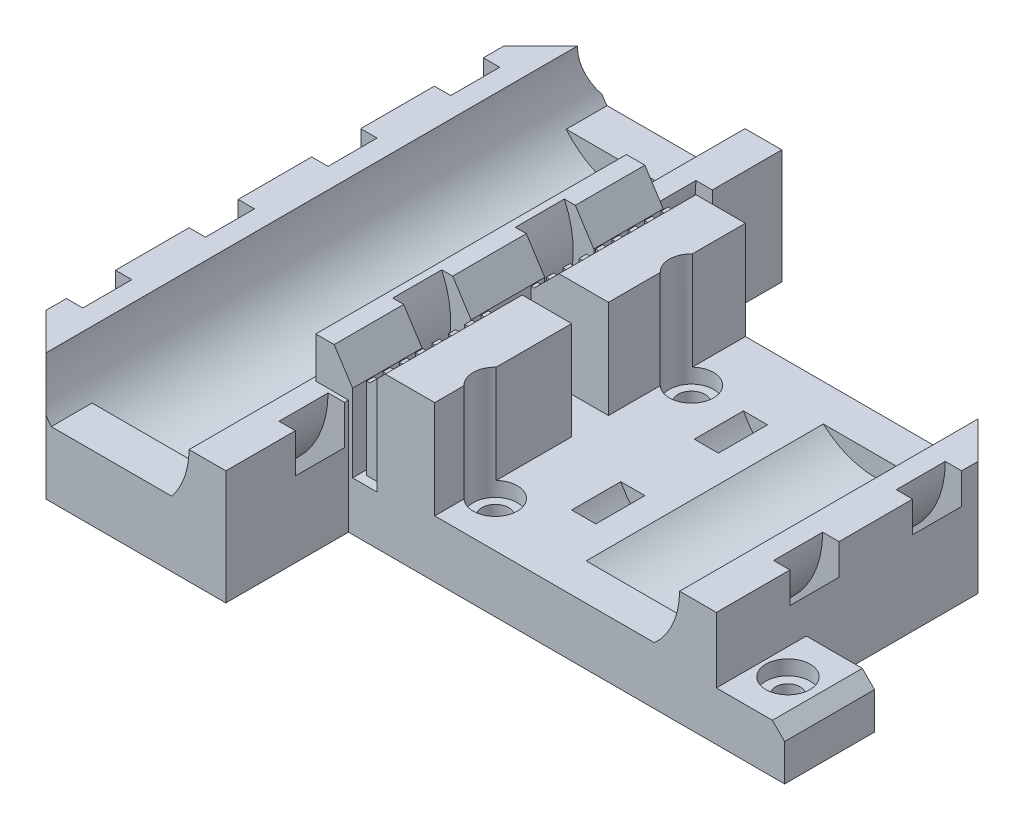
from build123d import *

# Parameters (mm, degrees)
SKETCH1_R           = 1.65
SKETCH1_R_2         = 1.5
BOSS_EXTRUDE1_DEPTH = 19
SKETCH2_W           = 28
SKETCH2_H           = 68
CUT_EXTRUDE1_DEPTH  = 5
SKETCH3_R           = 9.5
CUT_EXTRUDE2_DEPTH  = 79.787630581
SKETCH4_W           = 28
SKETCH4_H           = 5
BOSS_EXTRUDE3_DEPTH = 8
SKETCH5_W           = 2.8
SKETCH5_H           = 6
SKETCH7_W           = 4
SKETCH7_H           = 38
BOSS_EXTRUDE4_DEPTH = 5
SKETCH8_W           = 0.6
SKETCH8_H           = 38
CUT_EXTRUDE3_DEPTH  = 13
LPATTERN1_COUNT     = 4
LPATTERN1_PITCH     = 15
CUT_EXTRUDE4_DEPTH  = 54
SKETCH11_R          = 9.5
CUT_EXTRUDE6_DEPTH  = 75
SKETCH12_W          = 20.45
SKETCH12_H          = 38
CUT_EXTRUDE7_DEPTH  = 12
SKETCH14_W          = 14.272252789
SKETCH14_H          = 38
CUT_EXTRUDE9_DEPTH  = 5
SKETCH15_W          = 8.35
SKETCH15_H          = 11
CUT_EXTRUDE10_DEPTH = 8
SKETCH16_W          = 28.394140708
SKETCH16_H          = 4.5
SKETCH16_W_2        = 23.667282337
BOSS_EXTRUDE5_DEPTH = 7
SKETCH17_W          = 2.5
SKETCH17_H          = 6
LPATTERN2_COUNT     = 2
LPATTERN2_PITCH     = 15
SKETCH18_R          = 2.7
CUT_EXTRUDE11_DEPTH = 1.8
CUT_EXTRUDE12_START = 12
SKETCH19_R          = 2.7
CUT_EXTRUDE12_DEPTH = 13.8
SKETCH20_W          = 2.4
SKETCH20_H          = 1.11
CUT_EXTRUDE13_DEPTH = 13
LPATTERN3_COUNT     = 20
LPATTERN3_PITCH     = 2
CUT_EXTRUDE15_START = -19
SKETCH23_W          = 9.640158514
SKETCH23_H          = 12
CUT_EXTRUDE15_DEPTH = 2.25
CHAMFER2_SIZE       = 1.5
CHAMFER3_SIZE       = 6
CUT_EXTRUDE16_DEPTH = 56


with BuildPart() as part:
    # Sketch1 → Boss-Extrude1 (new body)
    with BuildSketch(Plane(origin=(0, 0, 0), x_dir=(1, 0, 0), z_dir=(0, 1, 0))):
        Polygon((0.38789484, -8.215418094), (0.38789484, 6.784581906), (53.73789484, 6.784581906), (53.73789484, 17.784581906), (45.38789484, 17.784581906), (45.38789484, 44.784581906), (0.38789484, 44.784581906), (0.38789484, 59.784581906), (-27.61210516, 59.784581906), (-27.61210516, -8.215418094), align=None)
        with Locations(Location((12.78789484, 36.334581906, 0), (0, 0, 270))):
            Circle(SKETCH1_R, mode=Mode.SUBTRACT)
        with Locations(Location((12.78789484, 12.334581906, 0), (0, 0, 270))):
            Circle(SKETCH1_R, mode=Mode.SUBTRACT)
        with Locations(Location((48.58789484, 12.334581906, 0), (0, 0, 270))):
            Circle(SKETCH1_R_2, mode=Mode.SUBTRACT)
    extrude(amount=BOSS_EXTRUDE1_DEPTH)

    # Sketch2 → Cut-Extrude1 (cut)
    with BuildSketch(Plane(origin=(0, 19, 0), x_dir=(1, 0, 0), z_dir=(0, 1, 0))):
        with Locations((-13.61210516, 25.784581906)):
            Rectangle(SKETCH2_W, SKETCH2_H)
    extrude(amount=-CUT_EXTRUDE1_DEPTH, mode=Mode.SUBTRACT)

    # Sketch3 → Cut-Extrude2 (cut)
    with BuildSketch(Plane.XY.offset(8.215418094)):
        with Locations((-13.61210516, 14)):
            Circle(SKETCH3_R)
    extrude(amount=-CUT_EXTRUDE2_DEPTH, mode=Mode.SUBTRACT)

    # Sketch4 → Boss-Extrude3 (add)
    with BuildSketch(Plane.XZ):
        with Locations((-13.61210516, 5.715418094)):
            Rectangle(SKETCH4_W, SKETCH4_H)
        with Locations((-13.61210516, -57.284581906)):
            Rectangle(SKETCH4_W, SKETCH4_H)
    extrude(amount=-BOSS_EXTRUDE3_DEPTH)

    # Sketch5 → Cut-Revolve2 (revolve, cut)
    with BuildSketch(Plane(origin=(0, 14, 0), x_dir=(1, 0, 0), z_dir=(0, 1, 0))):
        with Locations((-27.01210516, 3.284581906)):
            Rectangle(SKETCH5_W, SKETCH5_H)
    cut_revolve2 = revolve(axis=Axis((-13.61210516, 14, -59.784581906), (0, 0, 1)), mode=Mode.SUBTRACT)

    # Sketch7 → Boss-Extrude4 (add)
    with BuildSketch(Plane(origin=(0, 14, 0), x_dir=(1, 0, 0), z_dir=(0, 1, 0))):
        with Locations((-1.61210516, 25.784581906)):
            Rectangle(SKETCH7_W, SKETCH7_H)
    extrude(amount=BOSS_EXTRUDE4_DEPTH)

    # Sketch8 → Cut-Extrude3 (cut)
    with BuildSketch(Plane(origin=(0, 19, 0), x_dir=(1, 0, 0), z_dir=(0, 1, 0))):
        with Locations((1.18789484, 25.784581906)):
            Rectangle(SKETCH8_W, SKETCH8_H)
    extrude(amount=-CUT_EXTRUDE3_DEPTH, mode=Mode.SUBTRACT)

    # LPattern1: Cut-Revolve2 ×4
    with Locations(*[(0, 0, -i * LPATTERN1_PITCH) for i in range(1, LPATTERN1_COUNT)]):
        add(cut_revolve2, mode=Mode.SUBTRACT)

    # Sketch9 → Cut-Extrude4 (cut)
    with BuildSketch(Plane.XY.offset(-6.784581906)):
        Polygon((0.88789484, 19), (-1.36210516, 19), (0.88789484, 15.5), align=None)
    extrude(amount=-CUT_EXTRUDE4_DEPTH, mode=Mode.SUBTRACT)

    # Sketch11 → Cut-Extrude6 (cut)
    with BuildSketch(Plane.XY.offset(-6.784581906)):
        with Locations((31.38789484, 14)):
            Circle(SKETCH11_R)
    extrude(amount=-CUT_EXTRUDE6_DEPTH, mode=Mode.SUBTRACT)

    # Sketch12 → Cut-Extrude7 (cut)
    with BuildSketch(Plane(origin=(0, 19, 0), x_dir=(1, 0, 0), z_dir=(0, 1, 0))):
        with Locations((21.16289484, 25.784581906)):
            Rectangle(SKETCH12_W, SKETCH12_H)
    extrude(amount=-CUT_EXTRUDE7_DEPTH, mode=Mode.SUBTRACT)

    # Sketch14 → Cut-Extrude9 (cut)
    with BuildSketch(Plane(origin=(0, 19, 0), x_dir=(1, 0, 0), z_dir=(0, 1, 0))):
        with Locations((46.601768445, 25.784581906)):
            Rectangle(SKETCH14_W, SKETCH14_H)
    extrude(amount=-CUT_EXTRUDE9_DEPTH, mode=Mode.SUBTRACT)

    # Sketch15 → Cut-Extrude10 (cut)
    with BuildSketch(Plane(origin=(0, 14, 0), x_dir=(1, 0, 0), z_dir=(0, 1, 0))):
        with Locations((49.56289484, 12.284581906)):
            Rectangle(SKETCH15_W, SKETCH15_H)
    extrude(amount=-CUT_EXTRUDE10_DEPTH, mode=Mode.SUBTRACT)

    # Sketch16 → Boss-Extrude5 (add)
    with BuildSketch(Plane(origin=(0, 0, 0), x_dir=(-1, 0, 0), z_dir=(0, -1, 0))):
        with Locations((-30.406511334, 9.034581906)):
            Rectangle(SKETCH16_W, SKETCH16_H)
        with Locations((-33.554253671, 42.534581906)):
            Rectangle(SKETCH16_W_2, SKETCH16_H)
    extrude(amount=-BOSS_EXTRUDE5_DEPTH)

    # Sketch17 → Cut-Revolve3 (revolve, cut)
    with BuildSketch(Plane(origin=(0, 14, 0), x_dir=(1, 0, 0), z_dir=(0, 1, 0))):
        with Locations((44.63789484, 18.784581906)):
            Rectangle(SKETCH17_W, SKETCH17_H)
    cut_revolve3 = revolve(axis=Axis((31.38789484, 14, -44.784581906), (0, 0, 1)), mode=Mode.SUBTRACT)

    # LPattern2: Cut-Revolve3 ×2
    with Locations(*[(0, 0, -i * LPATTERN2_PITCH) for i in range(1, LPATTERN2_COUNT)]):
        add(cut_revolve3, mode=Mode.SUBTRACT)

    # Sketch18 → Cut-Extrude11 (cut)
    with BuildSketch(Plane(origin=(0, 6, 0), x_dir=(1, 0, 0), z_dir=(0, 1, 0))):
        with Locations(Location((48.58789484, 12.334581906, 0), (0, 0, 270))):
            Circle(SKETCH18_R)
    extrude(amount=-CUT_EXTRUDE11_DEPTH, mode=Mode.SUBTRACT)

    # Sketch19 → Cut-Extrude12 (cut)
    with BuildSketch(Plane(origin=(0, 7, 0), x_dir=(1, 0, 0), z_dir=(0, 1, 0)).offset(CUT_EXTRUDE12_START)):
        with Locations(Location((12.78789484, 36.334581906, 0), (0, 0, 270))):
            Circle(SKETCH19_R)
        with Locations(Location((12.78789484, 12.334581906, 0), (0, 0, 270))):
            Circle(SKETCH19_R)
    extrude(amount=-CUT_EXTRUDE12_DEPTH, mode=Mode.SUBTRACT)

    # Sketch20 → Cut-Extrude13 (cut)
    with BuildSketch(Plane(origin=(0, 19, 0), x_dir=(1, 0, 0), z_dir=(0, 1, 0))):
        with Locations((2.68789484, 43.339581906)):
            Rectangle(SKETCH20_W, SKETCH20_H)
    cut_extrude13 = extrude(amount=-CUT_EXTRUDE13_DEPTH, mode=Mode.SUBTRACT)

    # LPattern3: Cut-Extrude13 ×20
    with Locations(*[(0, 0, i * LPATTERN3_PITCH) for i in range(1, LPATTERN3_COUNT)]):
        add(cut_extrude13, mode=Mode.SUBTRACT)

    # Sketch23 → Cut-Extrude15 (cut, symmetric)
    with BuildSketch(Plane.XY.offset(-6.784581906).offset(CUT_EXTRUDE15_START)):
        with Locations((6.117815583, 13)):
            Rectangle(SKETCH23_W, SKETCH23_H)
    extrude(amount=CUT_EXTRUDE15_DEPTH, both=True, mode=Mode.SUBTRACT)

    # Chamfer2
    chamfer2_edges = [part.edges().sort_by_distance(p)[0] for p in [
        (53.73789484, 6, -12.284581906),
    ]]
    chamfer(chamfer2_edges, length=CHAMFER2_SIZE)

    # Chamfer3
    chamfer3_edges = [part.edges().sort_by_distance(p)[0] for p in [
        (45.38789484, 7, -44.784581906),
        (-27.61210516, 7, -59.784581906),
        (-27.61210516, 7, 8.215418094),
    ]]
    chamfer(chamfer3_edges, length=CHAMFER3_SIZE)

    # Sketch24 → Cut-Extrude16 (cut)
    with BuildSketch(Plane(origin=(0, 0, -44.784581906), x_dir=(-1, 0, 0), z_dir=(0, 0, -1))):
        Polygon((-1.48789484, 19), (-1.48789484, 16), (-1.88789484, 16), (-4.88789484, 19), align=None)
    extrude(amount=-CUT_EXTRUDE16_DEPTH, mode=Mode.SUBTRACT)


solid = part.part
